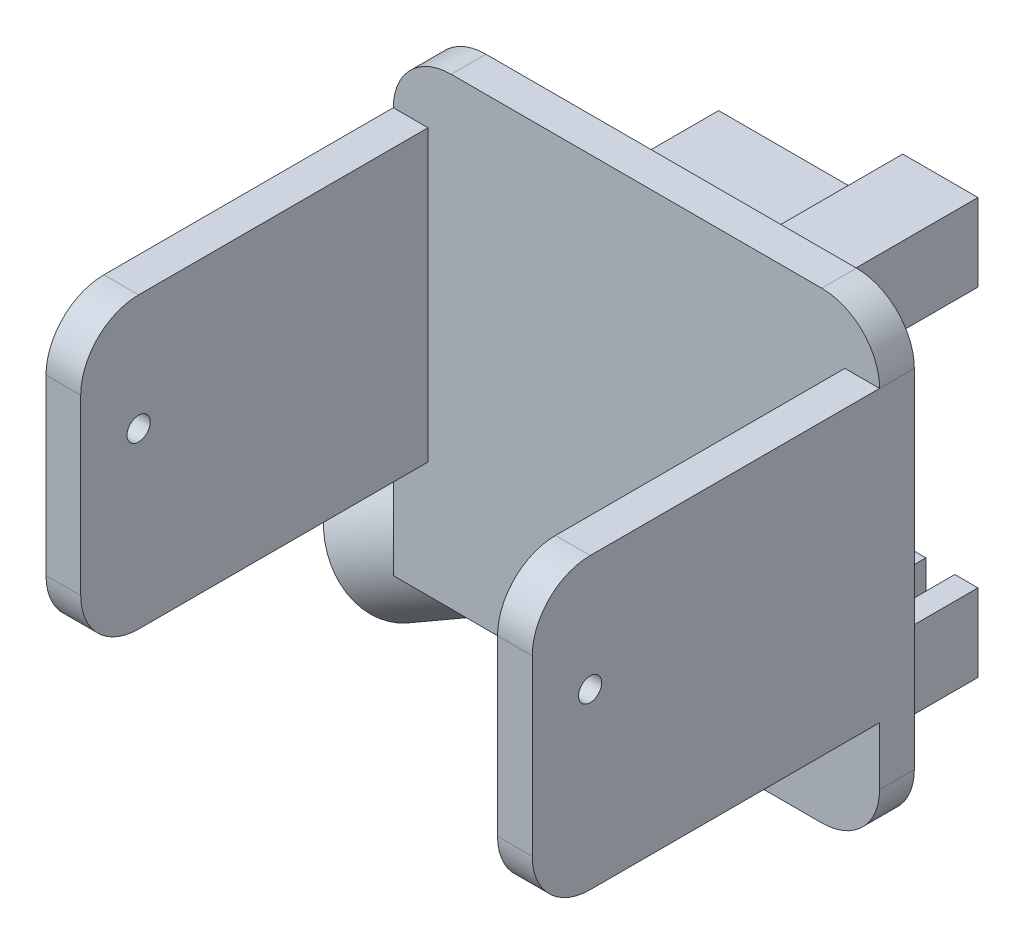
from build123d import *

# Parameters (mm, degrees)
BOSS_EXTRUDE1_DEPTH   = 11.8
BOSS_EXTRUDE1_2_DEPTH = 11.8
BOSS_EXTRUDE2_DEPTH   = 3
SKETCH3_W             = 3
SKETCH3_H             = 25
BOSS_EXTRUDE3_DEPTH   = 30
SKETCH4_R             = 1
CUT_EXTRUDE1_DEPTH    = 53
FILLET1_R             = 5
SKETCH6_R             = 5.9
SKETCH6_R_2           = 5
BOSS_EXTRUDE7_DEPTH   = 25
SKETCH8_W             = 71.563779341
SKETCH8_H             = 7.879641764
SKETCH8_H_2           = 53.845835152
CUT_EXTRUDE2_DEPTH    = 25
SKETCH9_W             = 23.699586064
SKETCH9_H             = 40
CUT_EXTRUDE3_DEPTH    = 3
FILLET2_R             = 5


with BuildPart() as part:
    # Sketch1 → Boss-Extrude1 (new body)
    with BuildSketch(Plane.XY):
        Polygon((4.5, 0), (0, 0), (0, 22.5), (15.9, 22.5), (15.9, 27.2), (18.4, 27.2), (18.4, 22.5), (20.4, 22.5), (20.4, 24.5), (20.4, 29.2), (13.9, 29.2), (13.9, 24.5), (-2, 24.5), (-2, -2), (4.5, -2), align=None)
    extrude(amount=BOSS_EXTRUDE1_DEPTH)



with BuildPart() as body_2:
    # Sketch1 → Boss-Extrude1 2 (new body)
    with BuildSketch(Plane.XY):
        Polygon((20.4, -2), (20.4, 0), (18.4, 0), (18.4, -4.7), (15.9, -4.7), (15.9, 0), (5.7, 0), (5.7, -2), (13.9, -2), (13.9, -6.7), (20.4, -6.7), align=None)
    extrude(amount=BOSS_EXTRUDE1_2_DEPTH)


with BuildPart() as part_1:
    add(part.part)

    add(body_2.part)  # Boss-Extrude2 merges body 2
    # Sketch2 → Boss-Extrude2 (add)
    # profile 1 of 2: a face of its own
    with BuildSketch(Plane.XY.offset(11.8)):
        Polygon((26.7, -11.773069414), (26.7, 36.562844017), (-38.999586064, 36.562844017), (-38.999586064, -56.162231559), (26.7, -56.162231559), align=None)
        Polygon((4.5, -2), (-2, -2), (-2, 24.5), (13.9, 24.5), (13.9, 29.2), (20.4, 29.2), (20.4, 22.5), (18.4, 22.5), (18.4, 27.2), (15.9, 27.2), (15.9, 22.5), (0, 22.5), (0, 0), (4.5, 0), align=None, mode=Mode.SUBTRACT)
    # profile 2 of 2: a face of its own
    with BuildSketch(Plane.XY.offset(11.8)):
        Polygon((-2, 24.5), (-2, -2), (4.5, -2), (4.5, 0), (0, 0), (0, 22.5), (15.9, 22.5), (15.9, 27.2), (18.4, 27.2), (18.4, 22.5), (20.4, 22.5), (20.4, 29.2), (13.9, 29.2), (13.9, 24.5), align=None)
    extrude(amount=BOSS_EXTRUDE2_DEPTH)

    # Sketch3 → Boss-Extrude3 (add)
    with BuildSketch(Plane.XY.offset(14.8)):
        with Locations((-13.8, 12.966976744)):
            Rectangle(SKETCH3_W, SKETCH3_H)
        with Locations((25.2, 12.966976744)):
            Rectangle(SKETCH3_W, SKETCH3_H)
    extrude(amount=BOSS_EXTRUDE3_DEPTH)

    # Sketch4 → Cut-Extrude1 (cut)
    with BuildSketch(Plane(origin=(26.7, 0, 0), x_dir=(0, 0, -1), z_dir=(1, 0, 0))):
        with Locations((-39.8, 15.466976744)):
            Circle(SKETCH4_R)
    extrude(amount=-CUT_EXTRUDE1_DEPTH, mode=Mode.SUBTRACT)

    # Fillet1
    fillet1_edges = [part_1.edges().sort_by_distance(p)[0] for p in [
        (-13.8, 25.466976744, 44.8),
        (-13.8, 0.466976744, 44.8),
        (25.2, 0.466976744, 44.8),
        (25.2, 25.466976744, 44.8),
    ]]
    fillet(fillet1_edges, radius=FILLET1_R)

    # Sketch8 → Cut-Extrude2 (cut)
    with BuildSketch(Plane(origin=(0, 0, 11.8), x_dir=(-1, 0, 0), z_dir=(0, 0, -1))):
        with Locations((6.751034935, 34.406797626)):
            Rectangle(SKETCH8_W, SKETCH8_H)
        with Locations((6.751034935, -36.455940832)):
            Rectangle(SKETCH8_W, SKETCH8_H_2)
    extrude(amount=-CUT_EXTRUDE2_DEPTH, mode=Mode.SUBTRACT)

    # Sketch9 → Cut-Extrude3 (cut)
    with BuildSketch(Plane.XY.offset(14.8)):
        with Locations((-27.149793032, 10.466976744)):
            Rectangle(SKETCH9_W, SKETCH9_H)
    extrude(amount=-CUT_EXTRUDE3_DEPTH, mode=Mode.SUBTRACT)

    # Fillet2
    fillet2_edges = [part_1.edges().sort_by_distance(p)[0] for p in [
        (26.7, -9.533023256, 13.3),
        (26.7, 30.466976744, 13.3),
        (-15.3, 30.466976744, 13.3),
    ]]
    fillet(fillet2_edges, radius=FILLET2_R)


with BuildPart() as body_2_2:
    # Sketch6 → Boss-Extrude7 (new body)
    with BuildSketch(Plane(origin=(-2.366025404, -1.366025404, 0), x_dir=(0, 0, 1), z_dir=(-0.866025403784438, -0.5000000000000012, 0))):
        with Locations(Location((5.9, -0.732050808, 0), (0, 0, 270))):
            Circle(SKETCH6_R)
        with Locations(Location((5.9, -0.732050808, 0), (0, 0, 270))):
            Circle(SKETCH6_R_2, mode=Mode.SUBTRACT)
    extrude(amount=BOSS_EXTRUDE7_DEPTH)


solid = Compound([part_1.part, body_2_2.part])
